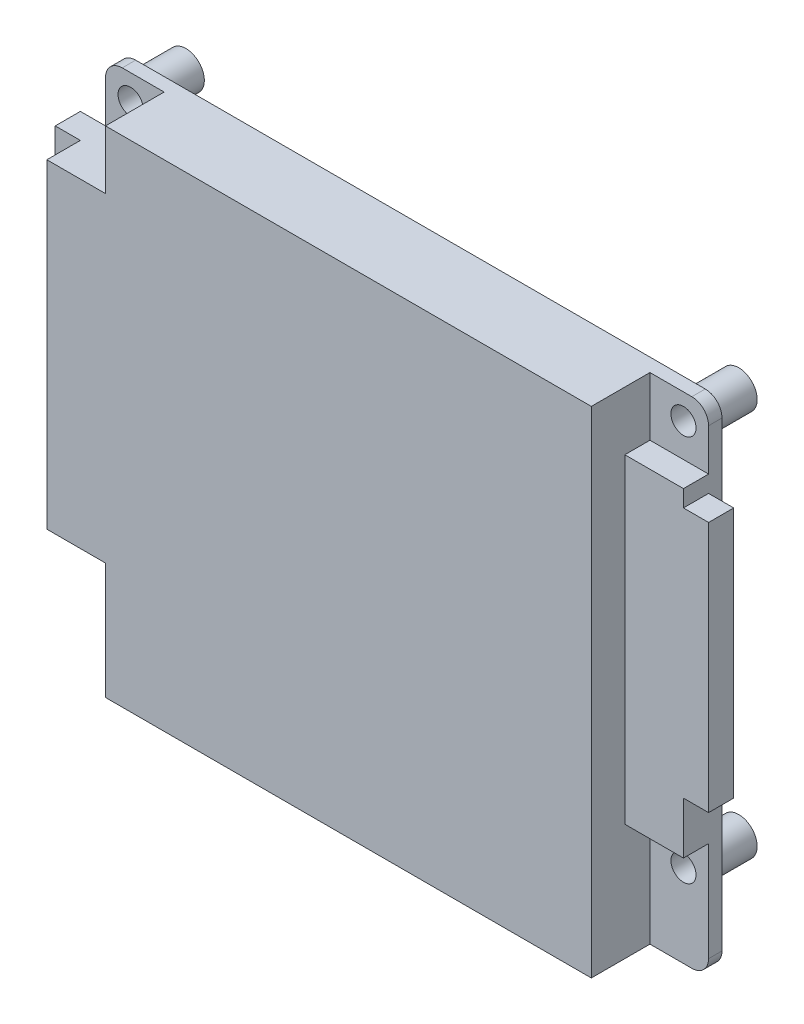
from build123d import *

# Parameters (mm, degrees)
EXTRUDE_1_DEPTH     = 1.6
SKETCH_2_R          = 1.5
CUT_EXTRUDE_1_DEPTH = 47.602172696
SKETCH_3_R          = 2.2
SKETCH_3_R_2        = 1.5
EXTRUDE_2_DEPTH     = 5
EXTRUDE_3_DEPTH     = 7
SKETCH_5_W          = 14
SKETCH_5_H          = 6
EXTRUDE_4_DEPTH     = 10
SKETCH_6_W          = 3
SKETCH_6_H          = 18
SKETCH_6_H_2        = 30
EXTRUDE_5_DEPTH     = 3
SKETCH_7_W          = 7
SKETCH_7_H          = 38.2
CUT_EXTRUDE_2_DEPTH = 4


with BuildPart() as part:
    # 草图1 → 凸台-拉伸1 (new body)
    with BuildSketch(Plane.XY):
        with BuildLine():
            Line((-34, -29.55), (34, -29.55))
            ThreePointArc((34, -29.55), (35.414213562, -28.964213562), (36, -27.55))
            Line((36, -27.55), (36, 27.55))
            ThreePointArc((36, 27.55), (35.414213562, 28.964213562), (34, 29.55))
            Line((34, 29.55), (-34, 29.55))
            ThreePointArc((-34, 29.55), (-35.414213562, 28.964213562), (-36, 27.55))
            Line((-36, 27.55), (-36, -27.55))
            ThreePointArc((-36, -27.55), (-35.414213562, -28.964213562), (-34, -29.55))
        make_face()
    extrude(amount=EXTRUDE_1_DEPTH)

    # 草图2 → 切除-拉伸1 (cut, through all)
    with BuildSketch(Plane.XY.offset(1.6)):
        with Locations((-33, 26.55)):
            Circle(SKETCH_2_R)
        with Locations((33, 26.55)):
            Circle(SKETCH_2_R)
        with Locations((-33, -19.65)):
            Circle(SKETCH_2_R)
        with Locations((33, -19.65)):
            Circle(SKETCH_2_R)
    extrude(amount=-CUT_EXTRUDE_1_DEPTH, mode=Mode.SUBTRACT)

    # 草图3 → 凸台-拉伸2 (add)
    # profile 1 of 4: a face of its own
    with BuildSketch(Plane(origin=(0, 0, 0), x_dir=(-1, 0, 0), z_dir=(0, 0, -1))):
        with Locations((33, 26.55)):
            Circle(SKETCH_3_R)
        with Locations(Location((33, 26.55, 0), (0, 0, 180))):
            Circle(SKETCH_3_R_2, mode=Mode.SUBTRACT)
    # profile 2 of 4: a face of its own
    with BuildSketch(Plane(origin=(0, 0, 0), x_dir=(-1, 0, 0), z_dir=(0, 0, -1))):
        with Locations((33, -19.65)):
            Circle(SKETCH_3_R)
        with Locations(Location((33, -19.65, 0), (0, 0, 180))):
            Circle(SKETCH_3_R_2, mode=Mode.SUBTRACT)
    # profile 3 of 4: a face of its own
    with BuildSketch(Plane(origin=(0, 0, 0), x_dir=(-1, 0, 0), z_dir=(0, 0, -1))):
        with Locations((-33, -19.65)):
            Circle(SKETCH_3_R)
        with Locations(Location((-33, -19.65, 0), (0, 0, 180))):
            Circle(SKETCH_3_R_2, mode=Mode.SUBTRACT)
    # profile 4 of 4: a face of its own
    with BuildSketch(Plane(origin=(0, 0, 0), x_dir=(-1, 0, 0), z_dir=(0, 0, -1))):
        with Locations((-33, 26.55)):
            Circle(SKETCH_3_R)
        with Locations(Location((-33, 26.55, 0), (0, 0, 180))):
            Circle(SKETCH_3_R_2, mode=Mode.SUBTRACT)
    extrude(amount=EXTRUDE_2_DEPTH)

    # 草图4 → 凸台-拉伸3 (add)
    with BuildSketch(Plane.XY.offset(1.6)):
        Polygon((-29, 29.55), (-29, 22.55), (-36, 22.55), (-36, -15.65), (-29, -15.65), (-29, -29.55), (29, -29.55), (29, -15.65), (36, -15.65), (36, 22.55), (29, 22.55), (29, 29.55), align=None)
    extrude(amount=EXTRUDE_3_DEPTH)

    # 草图5 → 凸台-拉伸4 (add)
    with BuildSketch(Plane(origin=(0, 0, 0), x_dir=(-1, 0, 0), z_dir=(0, 0, -1))):
        with Locations((27, -26.55)):
            Rectangle(SKETCH_5_W, SKETCH_5_H)
    extrude(amount=EXTRUDE_4_DEPTH)

    # 草图6 → 凸台-拉伸5 (add)
    with BuildSketch(Plane.XY.offset(1.6)):
        with Locations((-37.5, 13.55)):
            Rectangle(SKETCH_6_W, SKETCH_6_H)
        with Locations((37.5, 5.55)):
            Rectangle(SKETCH_6_W, SKETCH_6_H_2)
    extrude(amount=EXTRUDE_5_DEPTH)

    # 草图7 → 切除-拉伸2 (cut)
    with BuildSketch(Plane.XY.offset(8.6)):
        with Locations((32.5, 3.45)):
            Rectangle(SKETCH_7_W, SKETCH_7_H)
    extrude(amount=-CUT_EXTRUDE_2_DEPTH, mode=Mode.SUBTRACT)


solid = part.part
